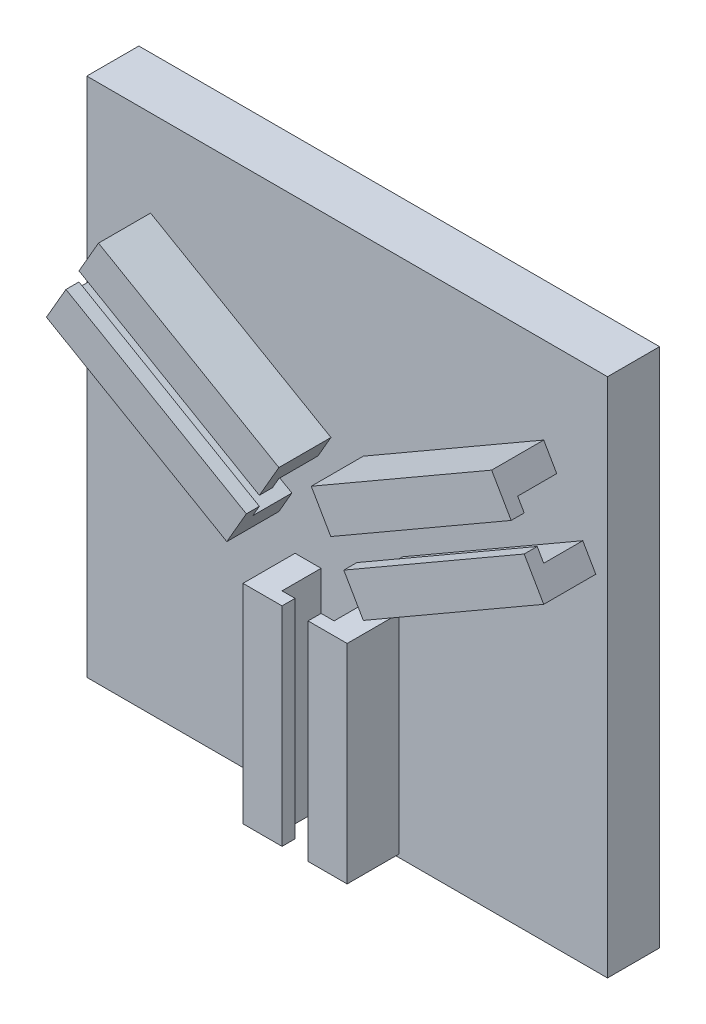
from build123d import *

# Parameters (mm, degrees)
SKETCH1_W           = 100
SKETCH1_H           = 100
BOSS_EXTRUDE1_DEPTH = 10
BOSS_EXTRUDE2_DEPTH = 10
CUT_EXTRUDE1_DEPTH  = 83.259731469
CIRPATTERN6_COUNT   = 3


with BuildPart() as part:
    # Sketch1 → Boss-Extrude1 (new body)
    with BuildSketch(Plane.XY):
        Rectangle(SKETCH1_W, SKETCH1_H)
    extrude(amount=BOSS_EXTRUDE1_DEPTH)

    # Sketch2 → Boss-Extrude2 (add)
    with BuildSketch(Plane.XY.offset(10)):
        Polygon((-47.749545474, 16.021207549), (-13.108529323, -3.978792451), (-3.108529323, 13.341715625), (-37.749545474, 33.341715625), align=None)
    boss_extrude2 = extrude(amount=BOSS_EXTRUDE2_DEPTH)

    # Sketch3 → Cut-Extrude1 (cut, through all)
    with BuildSketch(Plane(origin=(-8.108529323, 4.681461587, 0), x_dir=(0, 0, -1), z_dir=(0.8660254037844387, -0.4999999999999998, 0))):
        Polygon((-17.5, 5), (-10, 5), (-10, -5), (-17.5, -5), (-17.5, -2.5), (-20, -2.5), (-20, 2.5), (-17.5, 2.5), align=None)
    cut_extrude1 = extrude(amount=-CUT_EXTRUDE1_DEPTH, mode=Mode.SUBTRACT)

    # CirPattern6: Boss-Extrude2, Cut-Extrude1 ×3 about axis
    cirpattern6_axis = Axis((0, 0, 0), (0, 0, 1))
    add([boss_extrude2.rotate(cirpattern6_axis, i * 360 / CIRPATTERN6_COUNT) for i in range(1, CIRPATTERN6_COUNT)])
    add([cut_extrude1.rotate(cirpattern6_axis, i * 360 / CIRPATTERN6_COUNT) for i in range(1, CIRPATTERN6_COUNT)], mode=Mode.SUBTRACT)


solid = part.part
